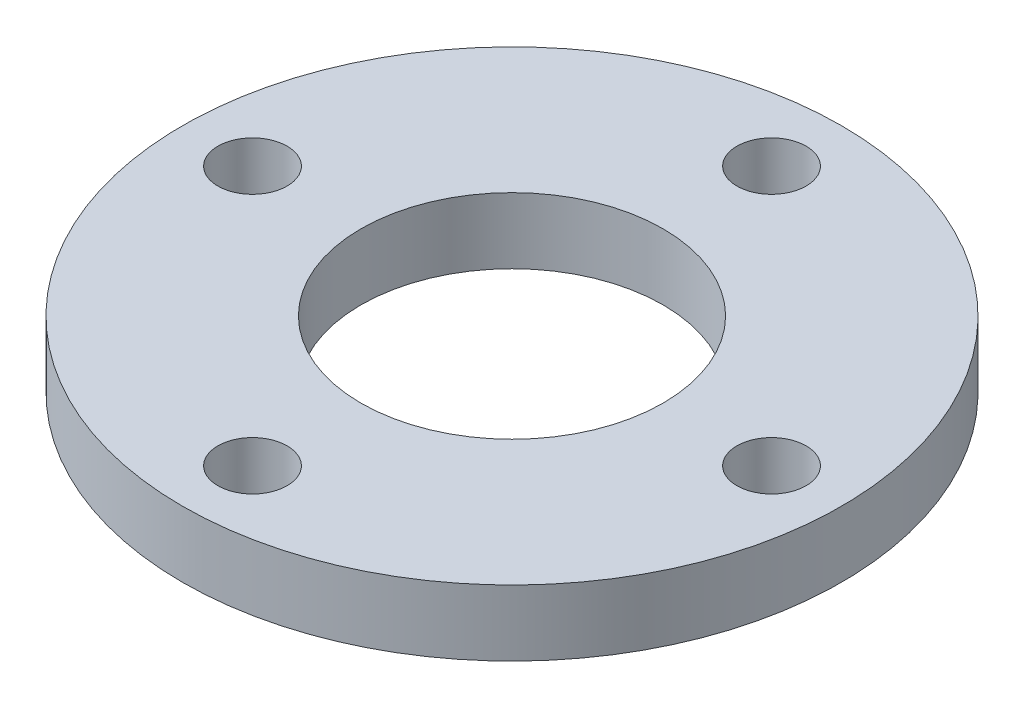
from build123d import *

# Parameters (mm, degrees)
SKETCH1_R           = 19.05
SKETCH1_R_2         = 8.73125
SKETCH1_R_3         = 2
BOSS_EXTRUDE1_DEPTH = 3.81


with BuildPart() as part:
    # Sketch1 → Boss-Extrude1 (new body)
    with BuildSketch(Plane(origin=(0, 0, 0), x_dir=(1, 0, 0), z_dir=(0, 1, 0))):
        with Locations(Location((0, 0, 0), (0, 0, 90))):
            Circle(SKETCH1_R)
        with Locations(Location((0, 0, 0), (0, 0, 90))):
            Circle(SKETCH1_R_2, mode=Mode.SUBTRACT)
        with Locations(Location((15.00124, 0, 0), (0, 0, 90))):
            Circle(SKETCH1_R_3, mode=Mode.SUBTRACT)
        with Locations(Location((0, 15.00124, 0), (0, 0, 90))):
            Circle(SKETCH1_R_3, mode=Mode.SUBTRACT)
        with Locations(Location((-15.00124, 0, 0), (0, 0, 90))):
            Circle(SKETCH1_R_3, mode=Mode.SUBTRACT)
        with Locations(Location((0, -15.00124, 0), (0, 0, 90))):
            Circle(SKETCH1_R_3, mode=Mode.SUBTRACT)
    extrude(amount=BOSS_EXTRUDE1_DEPTH)


solid = part.part
